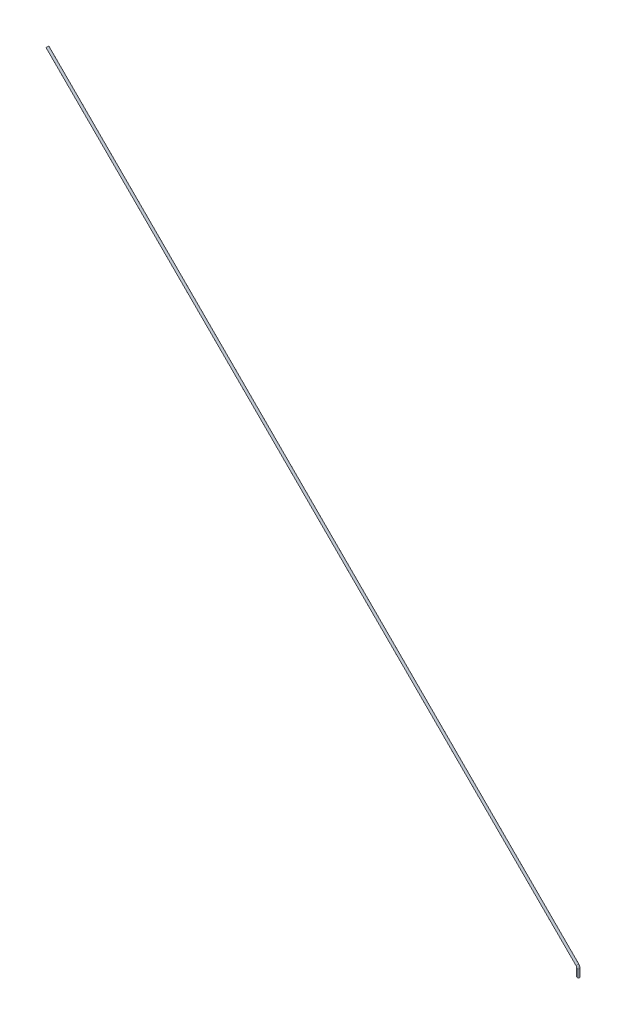
from build123d import *

# Parameters (mm, degrees)
SKETCH1_R           = 0.25
REVOLVE1_ANGLE      = 45
SKETCH2_R           = 0.25
BOSS_EXTRUDE1_DEPTH = 1.689339828
SKETCH3_R           = 0.25
BOSS_EXTRUDE2_DEPTH = 162.689339828


with BuildPart() as part:
    # Sketch1 → Revolve1 (revolve)
    with BuildSketch(Plane(origin=(-1.219669914, 1.219669914, 0), x_dir=(-0.707106781186546, -0.707106781186549, 0), z_dir=(-0.707106781186549, 0.707106781186546, 0))):
        with Locations((-1.414213562, 0)):
            Circle(SKETCH1_R)
    revolve(axis=Axis((-0.75, 1.689339828, -0.25), (0, 0, -1)), revolution_arc=REVOLVE1_ANGLE)

    # Sketch2 → Boss-Extrude1 (add)
    with BuildSketch(Plane.XZ.offset(-1.689339828)):
        Circle(SKETCH2_R)
    extrude(amount=BOSS_EXTRUDE1_DEPTH)

    # Sketch3 → Boss-Extrude2 (add)
    with BuildSketch(Plane(origin=(-1.219669914, 1.219669914, 0), x_dir=(0, 0, 1), z_dir=(-0.707106781186549, 0.707106781186546, 0))):
        with Locations(Location((0, 1.414213562, 0), (0, 0, 90))):
            Circle(SKETCH3_R)
    extrude(amount=BOSS_EXTRUDE2_DEPTH)


solid = part.part
